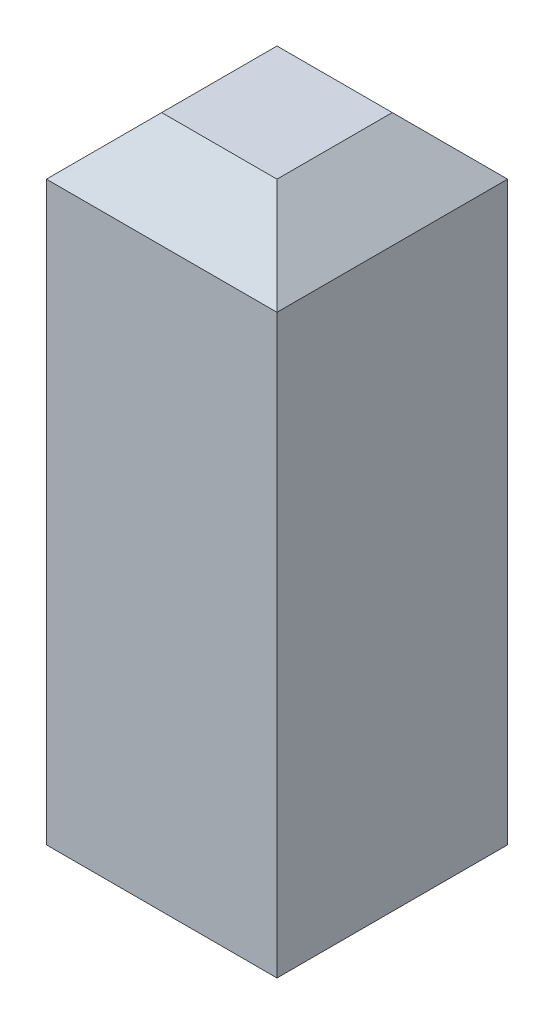
from build123d import *

# Parameters (mm, degrees)
SKETCH1_W           = 4
SKETCH1_H           = 4
BOSS_EXTRUDE1_DEPTH = 12
CHAMFER3_SIZE       = 1
CHAMFER4_SIZE       = 1


with BuildPart() as part:
    # Sketch1 → Boss-Extrude1 (new body)
    with BuildSketch(Plane(origin=(0, 0, 0), x_dir=(1, 0, 0), z_dir=(0, 1, 0))):
        Rectangle(SKETCH1_W, SKETCH1_H)
    extrude(amount=BOSS_EXTRUDE1_DEPTH)

    # Chamfer3
    chamfer3_edges = [part.edges().sort_by_distance(p)[0] for p in [
        (-2, 12, 0),
        (0, 12, 2),
        (2, 12, 0),
        (0, 12, -2),
    ]]
    chamfer(chamfer3_edges, length=CHAMFER3_SIZE)

    # Chamfer4
    chamfer4_edges = [part.edges().sort_by_distance(p)[0] for p in [
        (0, 0, 2),
        (-2, 0, 0),
        (0, 0, -2),
        (2, 0, 0),
    ]]
    chamfer(chamfer4_edges, length=CHAMFER4_SIZE)


solid = part.part
